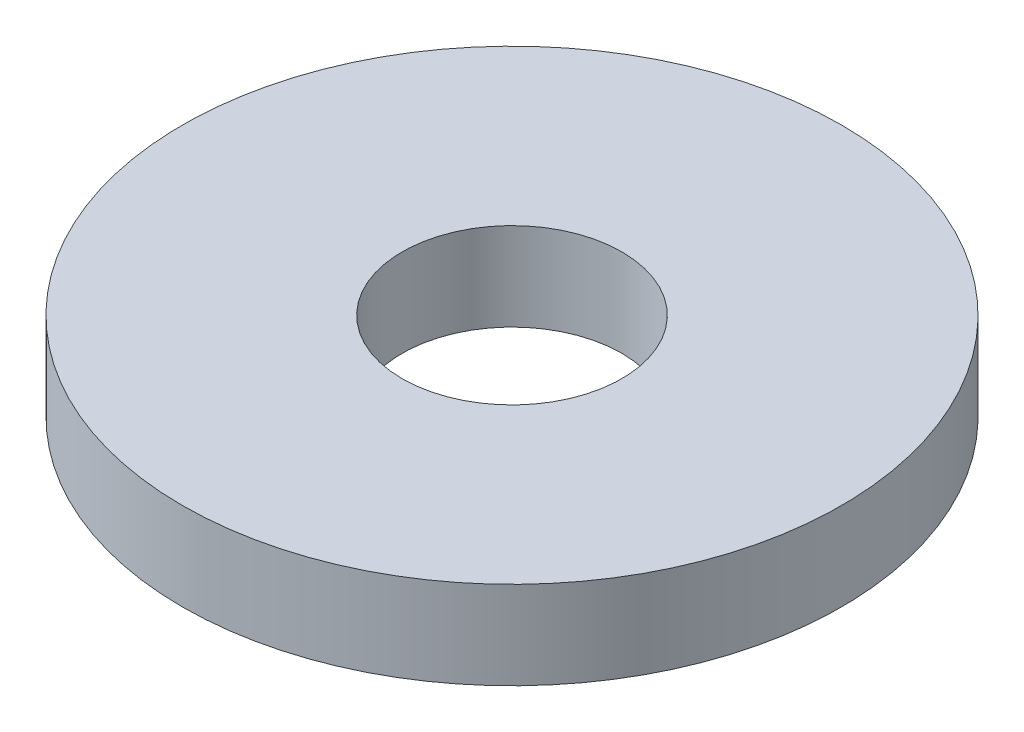
from build123d import *

# Parameters (mm, degrees)
SKETCH1_R           = 15
SKETCH1_R_2         = 5
BOSS_EXTRUDE1_DEPTH = 4


with BuildPart() as part:
    # Sketch1 → Boss-Extrude1 (new body)
    with BuildSketch(Plane(origin=(0, 0, 0), x_dir=(1, 0, 0), z_dir=(0, 1, 0))):
        with Locations(Location((0, 0, 0), (0, 0, 270))):
            Circle(SKETCH1_R)
        with Locations(Location((0, 0, 0), (0, 0, 270))):
            Circle(SKETCH1_R_2, mode=Mode.SUBTRACT)
    extrude(amount=BOSS_EXTRUDE1_DEPTH)


solid = part.part
